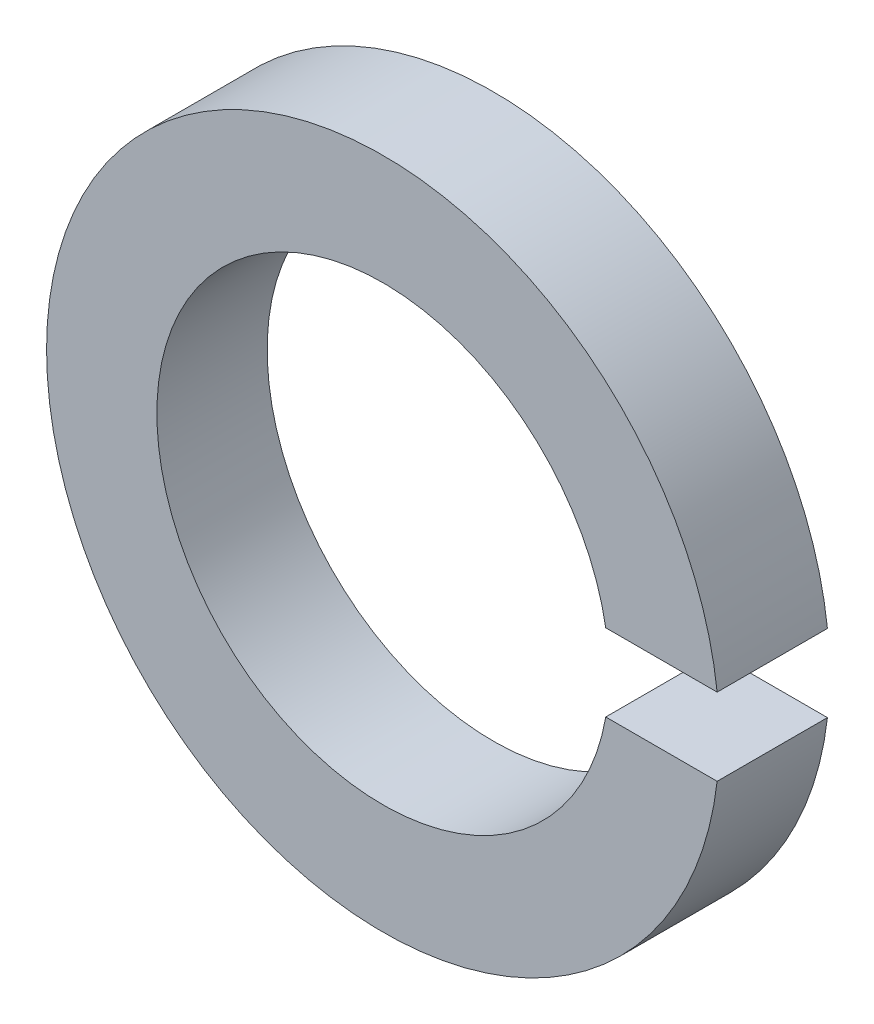
from build123d import *

# Parameters (mm, degrees)
SKETCH_1_R          = 6.1
SKETCH_1_R_2        = 4.1
EXTRUDE_1_DEPTH     = 2
SKETCH_2_W          = 2.271236488
SKETCH_2_H          = 1.4
CUT_EXTRUDE_1_DEPTH = 9.855506761


with BuildPart() as part:
    # Эскиз1 → Вытянуть1 (new body)
    with BuildSketch(Plane.XY):
        Circle(SKETCH_1_R)
        Circle(SKETCH_1_R_2, mode=Mode.SUBTRACT)
    extrude(amount=EXTRUDE_1_DEPTH)

    # Эскиз2 → Вырез-Вытянуть1 (cut, through all)
    with BuildSketch(Plane.XY.offset(2)):
        with Locations((5.095695926, 0)):
            Rectangle(SKETCH_2_W, SKETCH_2_H)
    extrude(amount=-CUT_EXTRUDE_1_DEPTH, mode=Mode.SUBTRACT)


solid = part.part
